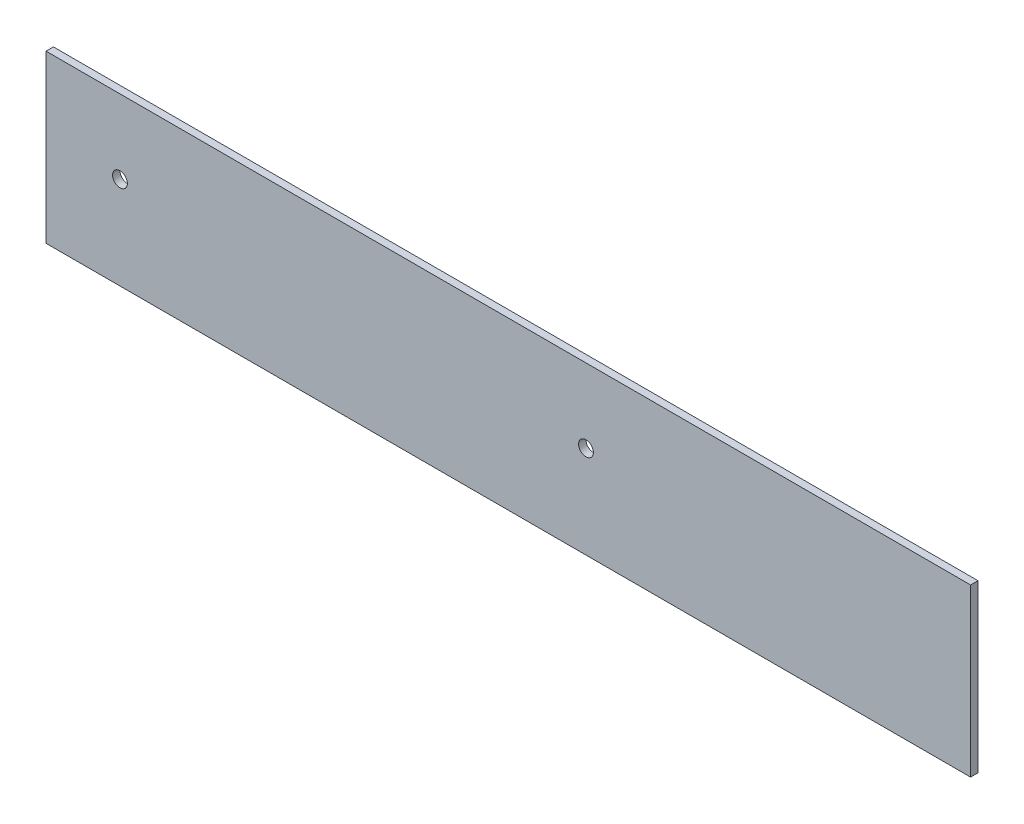
from build123d import *

# Parameters (mm, degrees)
SKETCH1_W               = 250
SKETCH1_H               = 45
BOSS_EXTRUDE1_DEPTH     = 2
CUT_EXTRUDE2_DEPTH      = 128.024603916
CUT_EXTRUDE2_DEPTH_BACK = 2
SKETCH2_R               = 2


with BuildPart() as part:
    # Sketch1 → Boss-Extrude1 (new body)
    with BuildSketch(Plane.XY):
        Rectangle(SKETCH1_W, SKETCH1_H)
    extrude(amount=BOSS_EXTRUDE1_DEPTH)

    # Sketch2 → Cut-Extrude2 (cut, two sides: drawn at the far end of the back side and taken through both)
    with BuildSketch(Plane.XY.offset(-CUT_EXTRUDE2_DEPTH_BACK)):
        with Locations((-105, 2.5)):
            Circle(SKETCH2_R)
        with Locations((21, 2.5)):
            Circle(SKETCH2_R)
    extrude(amount=CUT_EXTRUDE2_DEPTH + CUT_EXTRUDE2_DEPTH_BACK, mode=Mode.SUBTRACT)


solid = part.part
